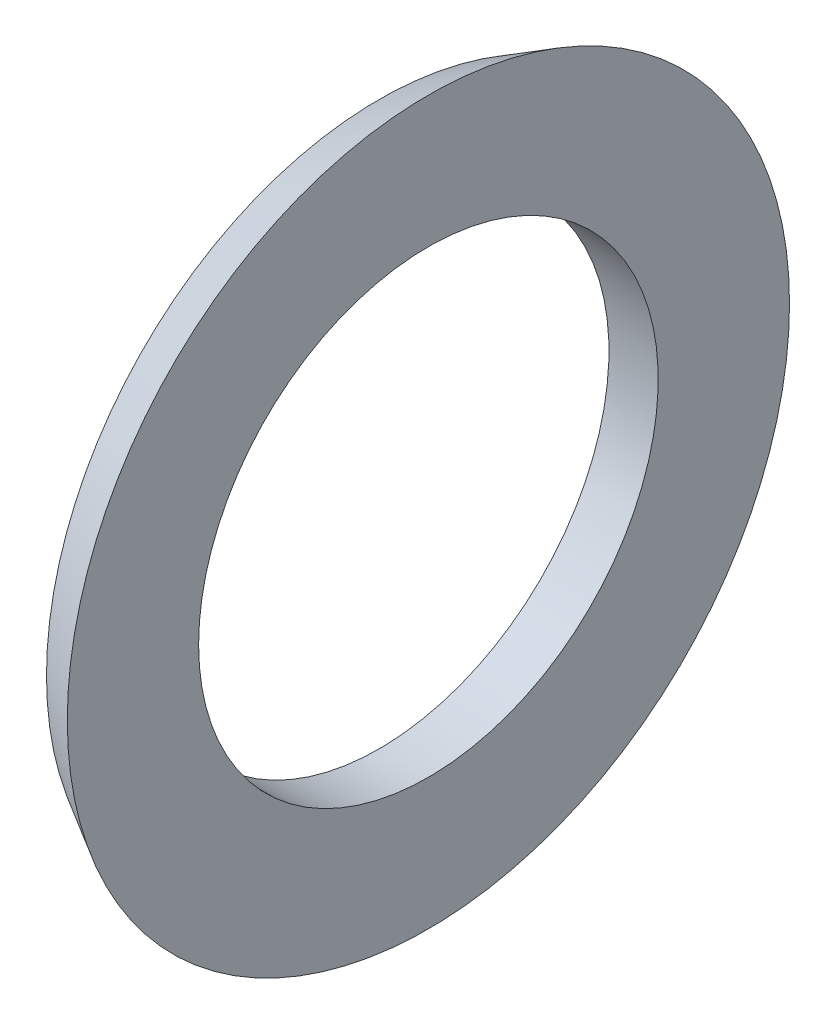
from build123d import *


with BuildPart() as part:
    # Esquisse1 → Base-Révolution (revolve)
    with BuildSketch(Plane.XY, mode=Mode.PRIVATE) as base_r_volution_sk:
        Polygon((0, 14), (0, 20.267949192), (3, 22), (3, 14), align=None)
    revolve(base_r_volution_sk.sketch.rotate(Axis((-20, 0, 0), (1, 0, 0)), 90), axis=Axis((-20, 0, 0), (1, 0, 0)))


solid = part.part
